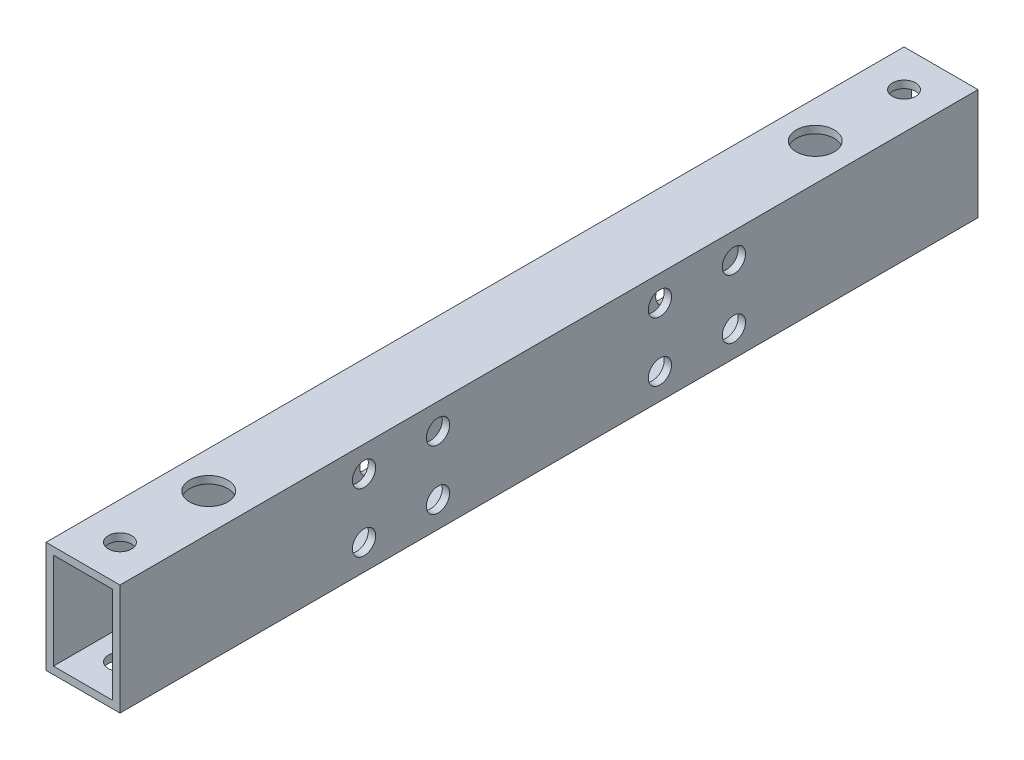
from build123d import *

# Parameters (mm, degrees)
SKETCH_1_W          = 10
SKETCH_1_H          = 15
SKETCH_1_W_2        = 8
SKETCH_1_H_2        = 13
EXTRUDE_1_DEPTH     = 116
SKETCH_2_R          = 1.575
SKETCH_2_R_2        = 2.575
CUT_EXTRUDE_1_DEPTH = 118.39250402
SKETCH_3_R          = 1.575
CUT_EXTRUDE_2_DEPTH = 118.39250402


with BuildPart() as part:
    # 草图1 → 拉伸-薄壁1 (new body)
    with BuildSketch(Plane.XY):
        with Locations((5, -7.5)):
            Rectangle(SKETCH_1_W, SKETCH_1_H)
        with Locations((5, -7.5)):
            Rectangle(SKETCH_1_W_2, SKETCH_1_H_2, mode=Mode.SUBTRACT)
    extrude(amount=EXTRUDE_1_DEPTH)

    # 草图2 → 切除-拉伸1 (cut, through all)
    with BuildSketch(Plane(origin=(0, 0, 0), x_dir=(1, 0, 0), z_dir=(0, 1, 0))):
        with Locations(Location((5, -5, 0), (0, 0, 270))):
            Circle(SKETCH_2_R)
        with Locations(Location((5, -17, 0), (0, 0, 270))):
            Circle(SKETCH_2_R_2)
        with Locations(Location((5, -99, 0), (0, 0, 270))):
            Circle(SKETCH_2_R_2)
        with Locations(Location((5, -111, 0), (0, 0, 270))):
            Circle(SKETCH_2_R)
    extrude(amount=-CUT_EXTRUDE_1_DEPTH, mode=Mode.SUBTRACT)

    # 草图3 → 切除-拉伸2 (cut, through all)
    with BuildSketch(Plane.ZY):
        with Locations(Location((33, -3.5, 0), (0, 0, 270))):
            Circle(SKETCH_3_R)
        with Locations(Location((43, -3.5, 0), (0, 0, 90))):
            Circle(SKETCH_3_R)
        with Locations(Location((43, -11.5, 0), (0, 0, 270))):
            Circle(SKETCH_3_R)
        with Locations(Location((33, -11.5, 0), (0, 0, 90))):
            Circle(SKETCH_3_R)
        with Locations(Location((83, -11.5, 0), (0, 0, 270))):
            Circle(SKETCH_3_R)
        with Locations(Location((73, -11.5, 0), (0, 0, 90))):
            Circle(SKETCH_3_R)
        with Locations(Location((73, -3.5, 0), (0, 0, 270))):
            Circle(SKETCH_3_R)
        with Locations(Location((83, -3.5, 0), (0, 0, 90))):
            Circle(SKETCH_3_R)
    extrude(amount=-CUT_EXTRUDE_2_DEPTH, mode=Mode.SUBTRACT)


solid = part.part
